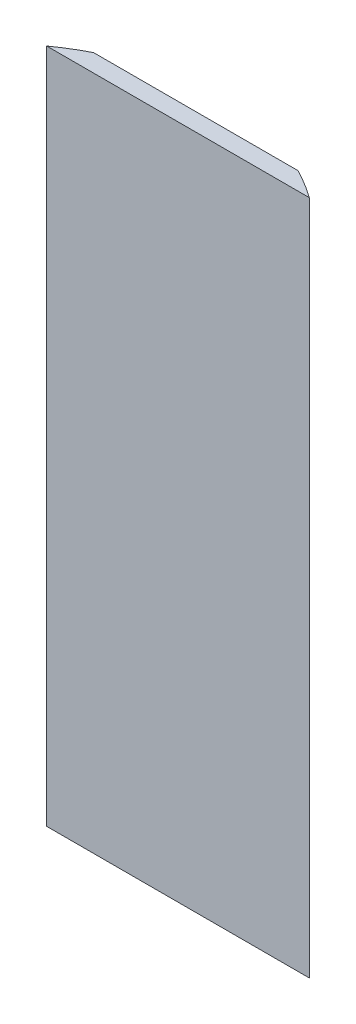
from build123d import *

# Parameters (mm, degrees)
BOSS_EXTRUDE1_DEPTH = 60.96


with BuildPart() as part:
    # Sketch1 → Boss-Extrude1 (new body)
    with BuildSketch(Plane(origin=(0, 0, 0), x_dir=(1, 0, 0), z_dir=(0, 1, 0))):
        with BuildLine():
            Line((-11.845771397, 16.51), (11.845771397, 16.51))
            ThreePointArc((11.845771397, 16.51), (10.56092259, 17.359991764), (9.215370636, 18.1102))
            Line((9.215370636, 18.1102), (-9.215370636, 18.1102))
            ThreePointArc((-9.215370636, 18.1102), (-10.56092259, 17.359991764), (-11.845771397, 16.51))
        make_face()
    extrude(amount=BOSS_EXTRUDE1_DEPTH)


solid = part.part
